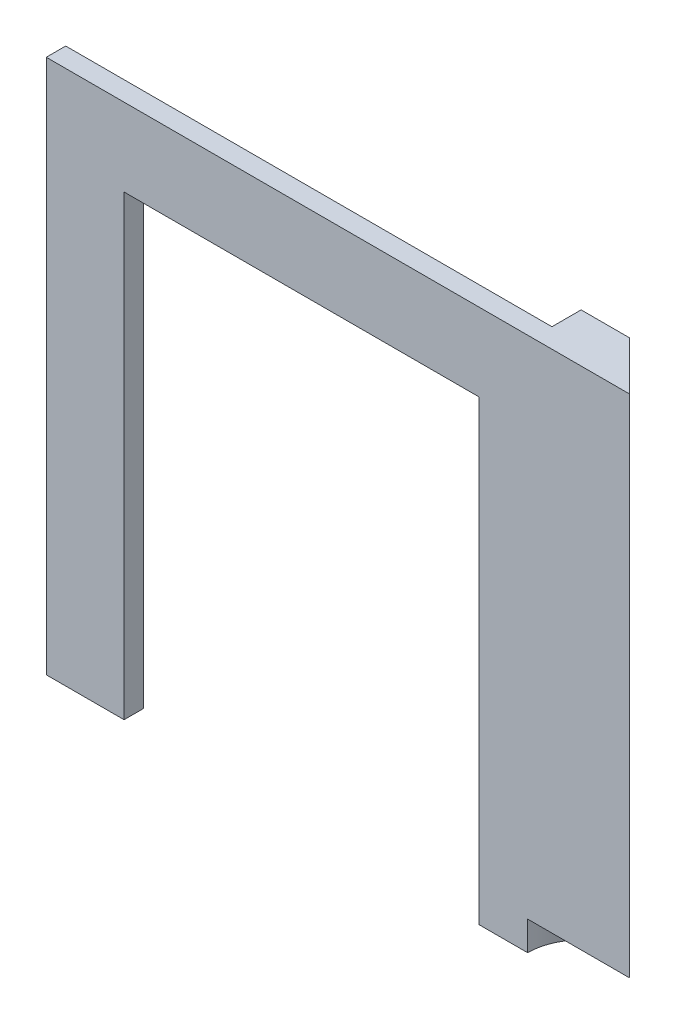
from build123d import *

# Parameters (mm, degrees)
BOSS_EXTRU_1_DEPTH      = 55
ESQUISSE2_W             = 36.5
ESQUISSE2_H             = 47
ENL_V_MAT_EXTRU_1_DEPTH = 65.730209331
ESQUISSE3_W             = 5.5
ESQUISSE3_H             = 8
ENL_V_MAT_EXTRU_2_DEPTH = 3
ESQUISSE4_R             = 5.5
ENL_V_MAT_EXTRU_3_DEPTH = 3


with BuildPart() as part:
    # Esquisse1 → Boss.-Extru.1 (new body)
    with BuildSketch(Plane(origin=(0, 0, 0), x_dir=(1, 0, 0), z_dir=(0, 1, 0))):
        Polygon((34, -2.5), (29, 2.5), (18.5, 2.5), (18.5, -0.5), (-26, -0.5), (-26, -2.5), align=None)
    extrude(amount=BOSS_EXTRU_1_DEPTH)

    # Esquisse2 → Enlèv. mat.-Extru.1 (cut, through all)
    with BuildSketch(Plane(origin=(0, 0, 0.5), x_dir=(-1, 0, 0), z_dir=(0, 0, -1))):
        with Locations((-0.25, 23.5)):
            Rectangle(ESQUISSE2_W, ESQUISSE2_H)
    extrude(amount=-ENL_V_MAT_EXTRU_1_DEPTH, mode=Mode.SUBTRACT)

    # Esquisse3 → Enlèv. mat.-Extru.2 (cut)
    with BuildSketch(Plane(origin=(0, 0, -2.5), x_dir=(-1, 0, 0), z_dir=(0, 0, -1))):
        with Locations((-21.25, 51)):
            Rectangle(ESQUISSE3_W, ESQUISSE3_H)
    extrude(amount=-ENL_V_MAT_EXTRU_2_DEPTH, mode=Mode.SUBTRACT)

    # Esquisse4 → Enlèv. mat.-Extru.3 (cut)
    with BuildSketch(Plane.XZ):
        with Locations((29, 2.5)):
            Circle(ESQUISSE4_R)
    extrude(amount=-ENL_V_MAT_EXTRU_3_DEPTH, mode=Mode.SUBTRACT)


solid = part.part
